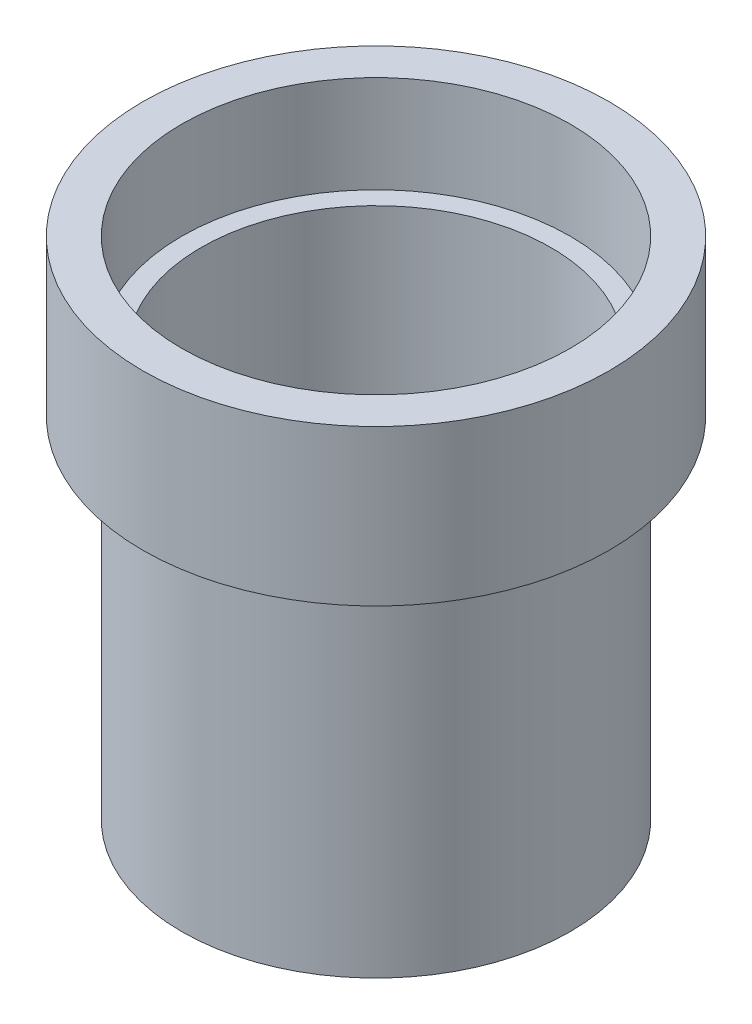
from build123d import *

# Parameters (mm, degrees)
ESQUISSE1_R        = 5
ESQUISSE1_R_2      = 4.5
BOSS_EXTRU_1_DEPTH = 9
ESQUISSE2_R        = 6
ESQUISSE2_R_2      = 5
ESQUISSE2_R_3      = 4.5
BOSS_EXTRU_2_DEPTH = 1.5
ESQUISSE3_R        = 6
ESQUISSE3_R_2      = 5
BOSS_EXTRU_3_DEPTH = 2.5


with BuildPart() as part:
    # Esquisse1 → Boss.-Extru.1 (new body)
    with BuildSketch(Plane(origin=(0, 0, 0), x_dir=(1, 0, 0), z_dir=(0, 1, 0))):
        with Locations(Location((0, 0, 0), (0, 0, 270))):
            Circle(ESQUISSE1_R)
        with Locations(Location((0, 0, 0), (0, 0, 270))):
            Circle(ESQUISSE1_R_2, mode=Mode.SUBTRACT)
    extrude(amount=BOSS_EXTRU_1_DEPTH)

    # Esquisse2 → Boss.-Extru.2 (add)
    # profile 1 of 2: a face of its own
    with BuildSketch(Plane(origin=(0, 9, 0), x_dir=(1, 0, 0), z_dir=(0, 1, 0))):
        with Locations(Location((0, 0, 0), (0, 0, 270))):
            Circle(ESQUISSE2_R)
        with Locations(Location((0, 0, 0), (0, 0, 270))):
            Circle(ESQUISSE2_R_2, mode=Mode.SUBTRACT)
    # profile 2 of 2: a face of its own
    with BuildSketch(Plane(origin=(0, 9, 0), x_dir=(1, 0, 0), z_dir=(0, 1, 0))):
        with Locations(Location((0, 0, 0), (0, 0, 270))):
            Circle(ESQUISSE2_R_2)
        with Locations(Location((0, 0, 0), (0, 0, 270))):
            Circle(ESQUISSE2_R_3, mode=Mode.SUBTRACT)
    extrude(amount=BOSS_EXTRU_2_DEPTH)

    # Esquisse3 → Boss.-Extru.3 (add)
    with BuildSketch(Plane(origin=(0, 10.5, 0), x_dir=(1, 0, 0), z_dir=(0, 1, 0))):
        with Locations(Location((0, 0, 0), (0, 0, 270))):
            Circle(ESQUISSE3_R)
        with Locations(Location((0, 0, 0), (0, 0, 270))):
            Circle(ESQUISSE3_R_2, mode=Mode.SUBTRACT)
    extrude(amount=BOSS_EXTRU_3_DEPTH)


solid = part.part
